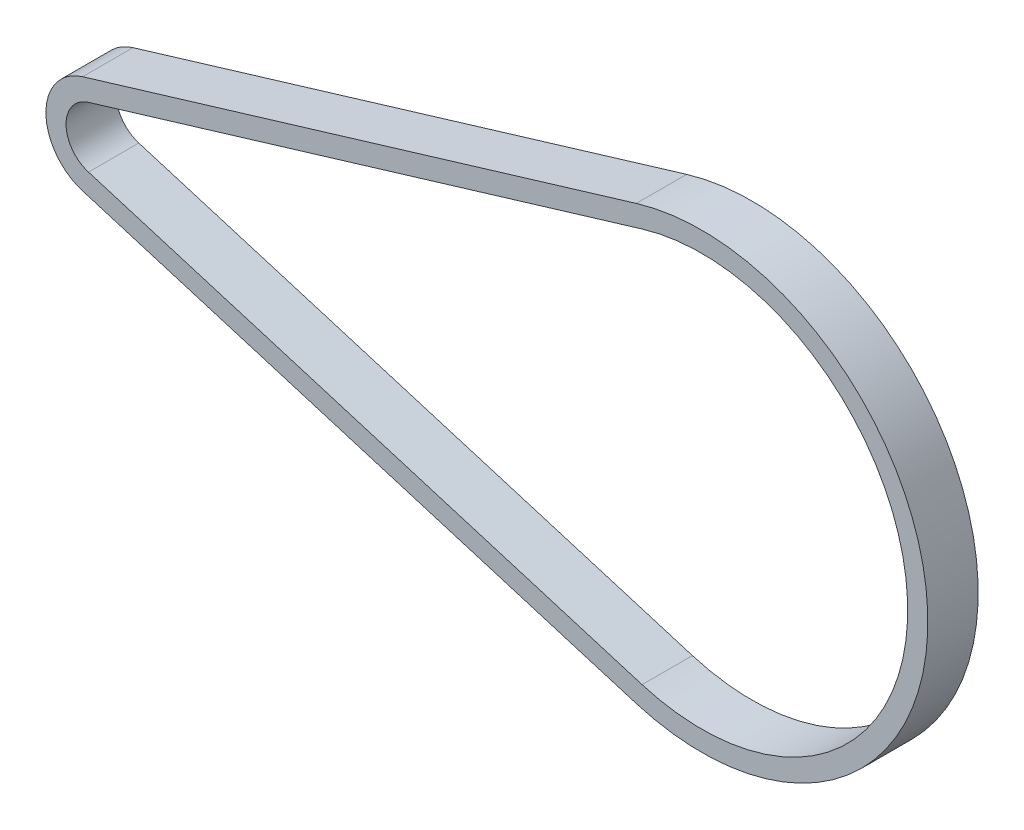
from build123d import *

# Parameters (mm, degrees)
EXTRUDE_THIN3_DEPTH = 25


with BuildPart() as part:
    # Sketch2 → Extrude-Thin3 (new body)
    with BuildSketch(Plane.XY):
        with BuildLine():
            Line((-27.856887447, 24.573475014), (247.097384094, 107.557991784))
            ThreePointArc((247.097384094, 107.557991784), (391.909683817, 0), (247.097384094, -107.557991784))
            Line((247.097384094, -107.557991784), (-27.856887447, -24.573475014))
            ThreePointArc((-27.856887447, -24.573475014), (-46.108607976, 0), (-27.856887447, 24.573475014))
        make_face()
        with BuildLine():
            Line((-24.967497174, 15), (249.986774367, 97.98451677))
            ThreePointArc((249.986774367, 97.98451677), (381.909683817, 0), (249.986774367, -97.98451677))
            Line((249.986774367, -97.98451677), (-24.967497174, -15))
            ThreePointArc((-24.967497174, -15), (-36.108607976, 0), (-24.967497174, 15))
        make_face(mode=Mode.SUBTRACT)
    extrude(amount=EXTRUDE_THIN3_DEPTH)


solid = part.part
